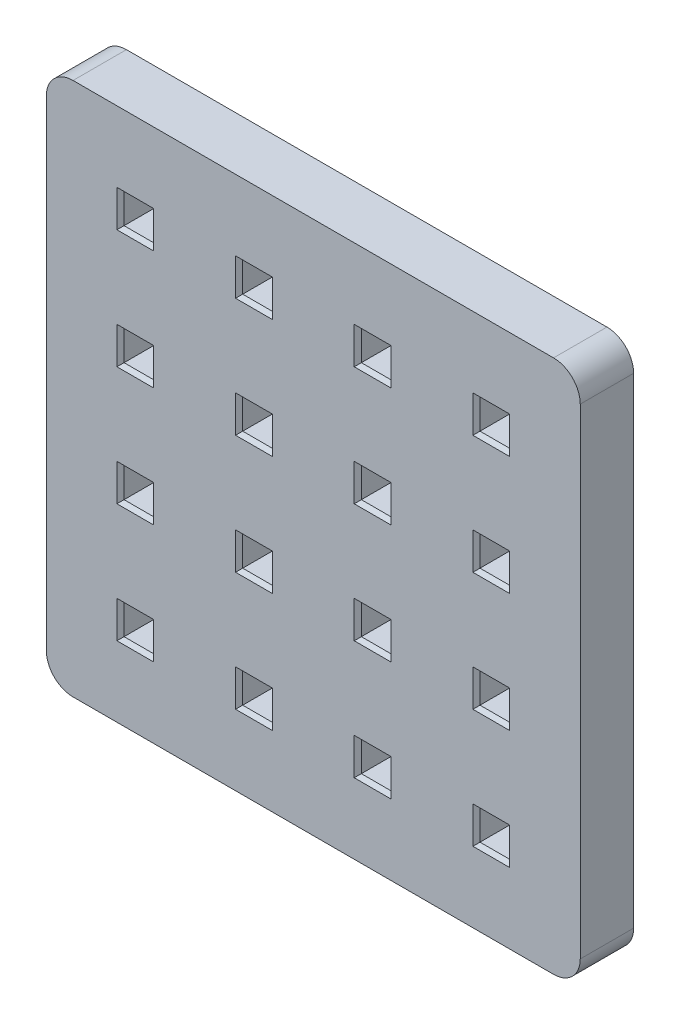
from build123d import *

# Parameters (mm, degrees)
SKETCH1_W                  = 200
SKETCH1_H                  = 200
BOSS_EXTRUDE1_DEPTH        = 20
SKETCH1_3_W                = 11.111111111
SKETCH1_3_H                = 11.111111111
CUT_EXTRUDE2_DEPTH         = 143.828568571
CHAMFER1_SIZE              = 1.333333333
LPATTERN1_COUNT            = 4
LPATTERN1_PITCH            = 44.444444444
LPATTERN1_COUNT_DIR2       = 4
LPATTERN1_PITCH_DIR2       = 44.444444444
CHAMFER1_OF_LPATTERN1_SIZE = 1.333333333
FILLET1_R                  = 10


with BuildPart() as part:
    # Sketch1 → Boss-Extrude1 (new body)
    with BuildSketch(Plane.XY):
        Rectangle(SKETCH1_W, SKETCH1_H)
    extrude(amount=-BOSS_EXTRUDE1_DEPTH)

    # Sketch1<3> → Cut-Extrude2 (cut, symmetric)
    with BuildSketch(Plane.XY):
        with Locations((66.666666667, 66.666666667)):
            Rectangle(SKETCH1_3_W, SKETCH1_3_H)
    cut_extrude2 = extrude(amount=CUT_EXTRUDE2_DEPTH, both=True, mode=Mode.SUBTRACT)

    # Chamfer1
    chamfer1_edges = [part.edges().sort_by_distance(p)[0] for p in [
        (61.111111111, 66.666666667, 0),
        (66.666666667, 61.111111111, 0),
        (72.222222222, 66.666666667, 0),
        (66.666666667, 72.222222222, 0),
        (72.222222222, 66.666666667, -20),
        (66.666666667, 72.222222222, -20),
        (61.111111111, 66.666666667, -20),
        (66.666666667, 61.111111111, -20),
    ]]
    chamfer(chamfer1_edges, length=CHAMFER1_SIZE)

    # LPattern1: Cut-Extrude2 4 × 4
    with Locations(*[(-i * LPATTERN1_PITCH, -j * LPATTERN1_PITCH_DIR2, 0) for i in range(LPATTERN1_COUNT) for j in range(LPATTERN1_COUNT_DIR2) if (i, j) != (0, 0)]):
        add(cut_extrude2, mode=Mode.SUBTRACT)

    # Chamfer1 of LPattern1
    chamfer1_of_lpattern1_edges = [part.edges().sort_by_distance(p)[0] for p in [
        (61.111111111, 22.222222222, 0),
        (66.666666667, 16.666666667, 0),
        (72.222222222, 22.222222222, 0),
        (66.666666667, 27.777777778, 0),
        (72.222222222, 22.222222222, -20),
        (66.666666667, 27.777777778, -20),
        (61.111111111, 22.222222222, -20),
        (66.666666667, 16.666666667, -20),
        (61.111111111, -22.222222222, 0),
        (66.666666667, -27.777777778, 0),
        (72.222222222, -22.222222222, 0),
        (66.666666667, -16.666666667, 0),
        (72.222222222, -22.222222222, -20),
        (66.666666667, -16.666666667, -20),
        (61.111111111, -22.222222222, -20),
        (66.666666667, -27.777777778, -20),
        (61.111111111, -66.666666667, 0),
        (66.666666667, -72.222222222, 0),
        (72.222222222, -66.666666667, 0),
        (66.666666667, -61.111111111, 0),
        (72.222222222, -66.666666667, -20),
        (66.666666667, -61.111111111, -20),
        (61.111111111, -66.666666667, -20),
        (66.666666667, -72.222222222, -20),
        (16.666666667, 66.666666667, 0),
        (22.222222222, 61.111111111, 0),
        (27.777777778, 66.666666667, 0),
        (22.222222222, 72.222222222, 0),
        (27.777777778, 66.666666667, -20),
        (22.222222222, 72.222222222, -20),
        (16.666666667, 66.666666667, -20),
        (22.222222222, 61.111111111, -20),
        (16.666666667, 22.222222222, 0),
        (22.222222222, 16.666666667, 0),
        (27.777777778, 22.222222222, 0),
        (22.222222222, 27.777777778, 0),
        (27.777777778, 22.222222222, -20),
        (22.222222222, 27.777777778, -20),
        (16.666666667, 22.222222222, -20),
        (22.222222222, 16.666666667, -20),
        (16.666666667, -22.222222222, 0),
        (22.222222222, -27.777777778, 0),
        (27.777777778, -22.222222222, 0),
        (22.222222222, -16.666666667, 0),
        (27.777777778, -22.222222222, -20),
        (22.222222222, -16.666666667, -20),
        (16.666666667, -22.222222222, -20),
        (22.222222222, -27.777777778, -20),
        (16.666666667, -66.666666667, 0),
        (22.222222222, -72.222222222, 0),
        (27.777777778, -66.666666667, 0),
        (22.222222222, -61.111111111, 0),
        (27.777777778, -66.666666667, -20),
        (22.222222222, -61.111111111, -20),
        (16.666666667, -66.666666667, -20),
        (22.222222222, -72.222222222, -20),
        (-27.777777778, 66.666666667, 0),
        (-22.222222222, 61.111111111, 0),
        (-16.666666667, 66.666666667, 0),
        (-22.222222222, 72.222222222, 0),
        (-16.666666667, 66.666666667, -20),
        (-22.222222222, 72.222222222, -20),
        (-27.777777778, 66.666666667, -20),
        (-22.222222222, 61.111111111, -20),
        (-27.777777778, 22.222222222, 0),
        (-22.222222222, 16.666666667, 0),
        (-16.666666667, 22.222222222, 0),
        (-22.222222222, 27.777777778, 0),
        (-16.666666667, 22.222222222, -20),
        (-22.222222222, 27.777777778, -20),
        (-27.777777778, 22.222222222, -20),
        (-22.222222222, 16.666666667, -20),
        (-27.777777778, -22.222222222, 0),
        (-22.222222222, -27.777777778, 0),
        (-16.666666667, -22.222222222, 0),
        (-22.222222222, -16.666666667, 0),
        (-16.666666667, -22.222222222, -20),
        (-22.222222222, -16.666666667, -20),
        (-27.777777778, -22.222222222, -20),
        (-22.222222222, -27.777777778, -20),
        (-27.777777778, -66.666666667, 0),
        (-22.222222222, -72.222222222, 0),
        (-16.666666667, -66.666666667, 0),
        (-22.222222222, -61.111111111, 0),
        (-16.666666667, -66.666666667, -20),
        (-22.222222222, -61.111111111, -20),
        (-27.777777778, -66.666666667, -20),
        (-22.222222222, -72.222222222, -20),
        (-72.222222222, 66.666666667, 0),
        (-66.666666667, 61.111111111, 0),
        (-61.111111111, 66.666666667, 0),
        (-66.666666667, 72.222222222, 0),
        (-61.111111111, 66.666666667, -20),
        (-66.666666667, 72.222222222, -20),
        (-72.222222222, 66.666666667, -20),
        (-66.666666667, 61.111111111, -20),
        (-72.222222222, 22.222222222, 0),
        (-66.666666667, 16.666666667, 0),
        (-61.111111111, 22.222222222, 0),
        (-66.666666667, 27.777777778, 0),
        (-61.111111111, 22.222222222, -20),
        (-66.666666667, 27.777777778, -20),
        (-72.222222222, 22.222222222, -20),
        (-66.666666667, 16.666666667, -20),
        (-72.222222222, -22.222222222, 0),
        (-66.666666667, -27.777777778, 0),
        (-61.111111111, -22.222222222, 0),
        (-66.666666667, -16.666666667, 0),
        (-61.111111111, -22.222222222, -20),
        (-66.666666667, -16.666666667, -20),
        (-72.222222222, -22.222222222, -20),
        (-66.666666667, -27.777777778, -20),
        (-72.222222222, -66.666666667, 0),
        (-66.666666667, -72.222222222, 0),
        (-61.111111111, -66.666666667, 0),
        (-66.666666667, -61.111111111, 0),
        (-61.111111111, -66.666666667, -20),
        (-66.666666667, -61.111111111, -20),
        (-72.222222222, -66.666666667, -20),
        (-66.666666667, -72.222222222, -20),
    ]]
    chamfer(chamfer1_of_lpattern1_edges, length=CHAMFER1_OF_LPATTERN1_SIZE)

    # Fillet1
    fillet1_edges = [part.edges().sort_by_distance(p)[0] for p in [
        (100, -100, -10),
        (100, 100, -10),
        (-100, 100, -10),
        (-100, -100, -10),
    ]]
    fillet(fillet1_edges, radius=FILLET1_R)


solid = part.part
